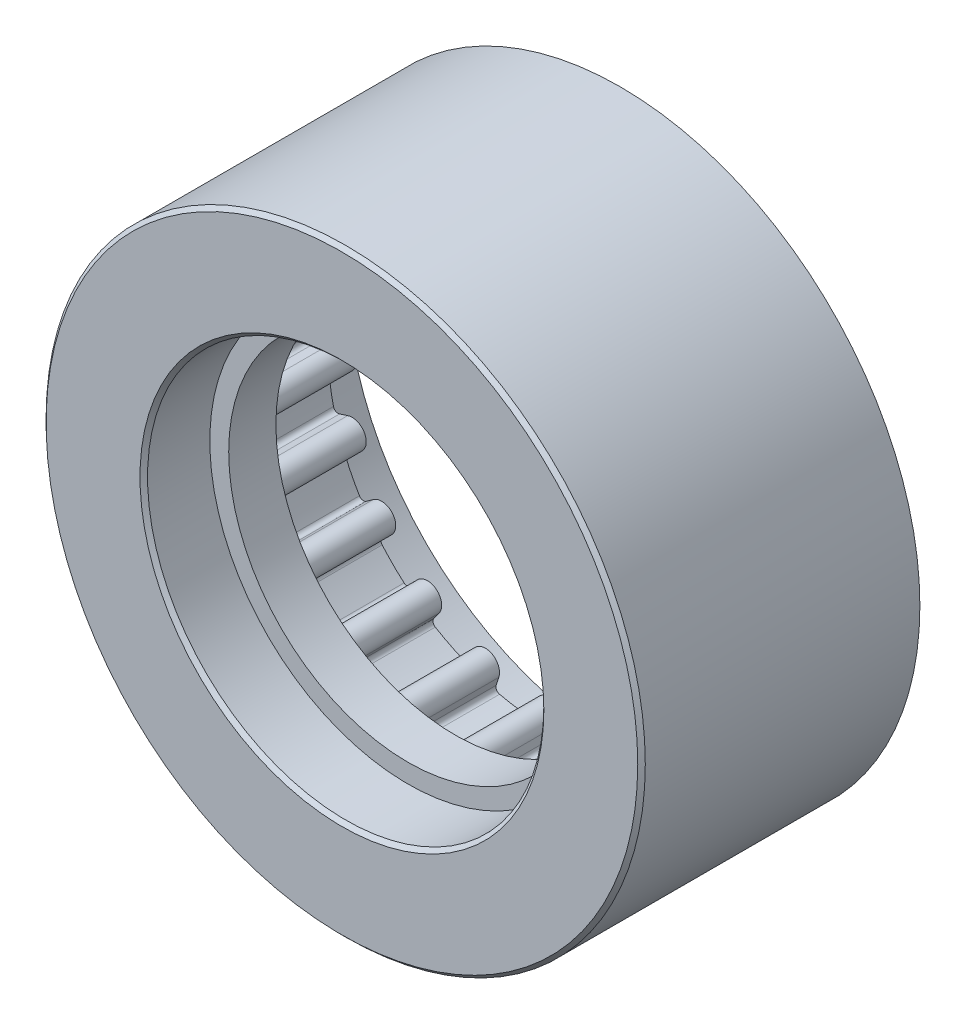
from build123d import *

# Parameters (mm, degrees)
SKIZZE1_W                       = 31.75
SKIZZE1_H                       = 17.5
SCHNITT_LINEAR_AUSTRAGEN1_DEPTH = 49.191026136
AUFSATZ_LINEAR_START            = 12
SKIZZE13_R                      = 31.75
SKIZZE13_R_2                    = 21
AUFSATZ_LINEAR_AUSTRAGEN1_DEPTH = 12
AUFSATZ_LINEAR_START_2          = -5
SKIZZE14_R                      = 21
SKIZZE14_R_2                    = 19
AUFSATZ_LINEAR_AUSTRAGEN2_DEPTH = 5
VERRUNDUNG1_R                   = 0.5
FASE5_SIZE                      = 0.4


with BuildPart() as part:
    # Skizze1 → Rotation1 (revolve)
    with BuildSketch(Plane.XZ, mode=Mode.PRIVATE) as rotation1_sk:
        with Locations((15.875, -0.15)):
            Rectangle(SKIZZE1_W, SKIZZE1_H)
    revolve(rotation1_sk.sketch.rotate(Axis((0, 0, 8.6), (0, 0, -1)), 180), axis=Axis((0, 0, 8.6), (0, 0, -1)))

    # Skizze2 → Schnitt-Linear austragen1 (cut, through all)
    with BuildSketch(Plane.XY.offset(8.6)):
        with BuildLine():
            ThreePointArc((1.5, 22), (0, 20.5), (-1.5, 22))
            Line((-1.5, 22), (-1.5, 23.452078799))
            ThreePointArc((-1.5, 23.452078799), (-3.676209928, 23.210676004), (-5.820506128, 22.767777854))
            Line((-5.820506128, 22.767777854), (-5.371789102, 21.38676885))
            ThreePointArc((-5.371789102, 21.38676885), (-5.316841365, 21.157895056), (-5.298373876, 20.923243358))
            ThreePointArc((-5.298373876, 20.923243358), (-6.563722179, 19.441710848), (-8.224958651, 20.459717867))
            Line((-8.224958651, 20.459717867), (-8.673675677, 21.840726871))
            ThreePointArc((-8.673675677, 21.840726871), (-10.668776744, 20.938653318), (-12.571260562, 19.85480818))
            Line((-12.571260562, 19.85480818), (-11.717750059, 18.680051755))
            ThreePointArc((-11.717750059, 18.680051755), (-11.504690776, 18.261899368), (-11.43127555, 17.798373876))
            ThreePointArc((-11.43127555, 17.798373876), (-12.467750059, 16.371789102), (-14.144801042, 16.916695998))
            Line((-14.144801042, 16.916695998), (-14.998311545, 18.091452423))
            ThreePointArc((-14.998311545, 18.091452423), (-16.617009358, 16.617009358), (-18.091452423, 14.998311545))
            Line((-18.091452423, 14.998311545), (-16.916695998, 14.144801042))
            ThreePointArc((-16.916695998, 14.144801042), (-16.46186409, 13.6122613), (-16.298373876, 12.93127555))
            ThreePointArc((-16.298373876, 12.93127555), (-17.117388127, 11.594765764), (-18.680051755, 11.717750059))
            Line((-18.680051755, 11.717750059), (-19.85480818, 12.571260562))
            ThreePointArc((-19.85480818, 12.571260562), (-20.938653318, 10.668776744), (-21.840726871, 8.673675677))
            Line((-21.840726871, 8.673675677), (-20.459717867, 8.224958651))
            ThreePointArc((-20.459717867, 8.224958651), (-19.709717867, 7.680051755), (-19.423243358, 6.798373876))
            ThreePointArc((-19.423243358, 6.798373876), (-20.04156548, 5.584848385), (-21.38676885, 5.371789102))
            Line((-21.38676885, 5.371789102), (-22.767777854, 5.820506128))
            ThreePointArc((-22.767777854, 5.820506128), (-23.210676004, 3.676209928), (-23.452078799, 1.5))
            Line((-23.452078799, 1.5), (-22, 1.5))
            ThreePointArc((-22, 1.5), (-20.939339828, 1.060660172), (-20.5, 0))
            ThreePointArc((-20.5, 0), (-20.939339828, -1.060660172), (-22, -1.5))
            Line((-22, -1.5), (-23.452078799, -1.5))
            ThreePointArc((-23.452078799, -1.5), (-23.210676004, -3.676209928), (-22.767777854, -5.820506128))
            Line((-22.767777854, -5.820506128), (-21.38676885, -5.371789102))
            ThreePointArc((-21.38676885, -5.371789102), (-20.04156548, -5.584848385), (-19.423243358, -6.798373876))
            ThreePointArc((-19.423243358, -6.798373876), (-19.709717867, -7.680051755), (-20.459717867, -8.224958651))
            Line((-20.459717867, -8.224958651), (-21.840726871, -8.673675677))
            ThreePointArc((-21.840726871, -8.673675677), (-20.938653318, -10.668776744), (-19.85480818, -12.571260562))
            Line((-19.85480818, -12.571260562), (-18.680051755, -11.717750059))
            ThreePointArc((-18.680051755, -11.717750059), (-17.117388127, -11.594765764), (-16.298373876, -12.93127555))
            ThreePointArc((-16.298373876, -12.93127555), (-16.46186409, -13.6122613), (-16.916695998, -14.144801042))
            Line((-16.916695998, -14.144801042), (-18.091452423, -14.998311545))
            ThreePointArc((-18.091452423, -14.998311545), (-16.617009358, -16.617009358), (-14.998311545, -18.091452423))
            Line((-14.998311545, -18.091452423), (-14.144801042, -16.916695998))
            ThreePointArc((-14.144801042, -16.916695998), (-12.467750059, -16.371789102), (-11.43127555, -17.798373876))
            ThreePointArc((-11.43127555, -17.798373876), (-11.504690776, -18.261899368), (-11.717750059, -18.680051755))
            Line((-11.717750059, -18.680051755), (-12.571260562, -19.85480818))
            ThreePointArc((-12.571260562, -19.85480818), (-10.668776744, -20.938653318), (-8.673675677, -21.840726871))
            Line((-8.673675677, -21.840726871), (-8.224958651, -20.459717867))
            ThreePointArc((-8.224958651, -20.459717867), (-6.563722179, -19.441710848), (-5.298373876, -20.923243358))
            ThreePointArc((-5.298373876, -20.923243358), (-5.316841365, -21.157895056), (-5.371789102, -21.38676885))
            Line((-5.371789102, -21.38676885), (-5.820506128, -22.767777854))
            ThreePointArc((-5.820506128, -22.767777854), (-3.676209928, -23.210676004), (-1.5, -23.452078799))
            Line((-1.5, -23.452078799), (-1.5, -22))
            ThreePointArc((-1.5, -22), (0, -20.5), (1.5, -22))
            Line((1.5, -22), (1.5, -23.452078799))
            ThreePointArc((1.5, -23.452078799), (3.676209928, -23.210676004), (5.820506128, -22.767777854))
            Line((5.820506128, -22.767777854), (5.371789102, -21.38676885))
            ThreePointArc((5.371789102, -21.38676885), (6.334848385, -19.496658584), (8.224958651, -20.459717867))
            Line((8.224958651, -20.459717867), (8.673675677, -21.840726871))
            ThreePointArc((8.673675677, -21.840726871), (10.668776744, -20.938653318), (12.571260562, -19.85480818))
            Line((12.571260562, -19.85480818), (11.717750059, -18.680051755))
            ThreePointArc((11.717750059, -18.680051755), (12.049597672, -16.584848385), (14.144801042, -16.916695998))
            Line((14.144801042, -16.916695998), (14.998311545, -18.091452423))
            ThreePointArc((14.998311545, -18.091452423), (16.617009358, -16.617009358), (18.091452423, -14.998311545))
            Line((18.091452423, -14.998311545), (16.916695998, -14.144801042))
            ThreePointArc((16.916695998, -14.144801042), (16.584848385, -12.049597672), (18.680051755, -11.717750059))
            Line((18.680051755, -11.717750059), (19.85480818, -12.571260562))
            ThreePointArc((19.85480818, -12.571260562), (20.938653318, -10.668776744), (21.840726871, -8.673675677))
            Line((21.840726871, -8.673675677), (20.459717867, -8.224958651))
            ThreePointArc((20.459717867, -8.224958651), (19.496658584, -6.334848385), (21.38676885, -5.371789102))
            Line((21.38676885, -5.371789102), (22.767777854, -5.820506128))
            ThreePointArc((22.767777854, -5.820506128), (23.210676004, -3.676209928), (23.452078799, -1.5))
            Line((23.452078799, -1.5), (22, -1.5))
            ThreePointArc((22, -1.5), (20.5, 0), (22, 1.5))
            Line((22, 1.5), (23.452078799, 1.5))
            ThreePointArc((23.452078799, 1.5), (23.210676004, 3.676209928), (22.767777854, 5.820506128))
            Line((22.767777854, 5.820506128), (21.38676885, 5.371789102))
            ThreePointArc((21.38676885, 5.371789102), (19.496658584, 6.334848385), (20.459717867, 8.224958651))
            Line((20.459717867, 8.224958651), (21.840726871, 8.673675677))
            ThreePointArc((21.840726871, 8.673675677), (20.938653318, 10.668776744), (19.85480818, 12.571260562))
            Line((19.85480818, 12.571260562), (18.680051755, 11.717750059))
            ThreePointArc((18.680051755, 11.717750059), (16.584848385, 12.049597672), (16.916695998, 14.144801042))
            Line((16.916695998, 14.144801042), (18.091452423, 14.998311545))
            ThreePointArc((18.091452423, 14.998311545), (16.617009358, 16.617009358), (14.998311545, 18.091452423))
            Line((14.998311545, 18.091452423), (14.144801042, 16.916695998))
            ThreePointArc((14.144801042, 16.916695998), (12.049597672, 16.584848385), (11.717750059, 18.680051755))
            Line((11.717750059, 18.680051755), (12.571260562, 19.85480818))
            ThreePointArc((12.571260562, 19.85480818), (10.668776744, 20.938653318), (8.673675677, 21.840726871))
            Line((8.673675677, 21.840726871), (8.224958651, 20.459717867))
            ThreePointArc((8.224958651, 20.459717867), (6.334848385, 19.496658584), (5.371789102, 21.38676885))
            Line((5.371789102, 21.38676885), (5.820506128, 22.767777854))
            ThreePointArc((5.820506128, 22.767777854), (3.676209928, 23.210676004), (1.5, 23.452078799))
            Line((1.5, 23.452078799), (1.5, 22))
        make_face()
    extrude(amount=-SCHNITT_LINEAR_AUSTRAGEN1_DEPTH, mode=Mode.SUBTRACT)

    # Skizze3 → Schnitt-Rotation1 (revolve, cut)
    with BuildSketch(Plane(origin=(0, 0, 0), x_dir=(1, 0, 0), z_dir=(0, 1, 0))):
        Polygon((29, 8.9), (0, 8.9), (0, 1.4), (26.5, 1.4), (27, 1.9), (29, 1.9), align=None)
    revolve(axis=Axis((0, 0, -8.9), (0, 0, 1)), mode=Mode.SUBTRACT)

    # Skizze13 → Aufsatz-Linear austragen1 (add)
    with BuildSketch(Plane.XY.offset(8.6).offset(AUFSATZ_LINEAR_START)):
        with Locations(Location((0, 0, 0), (0, 0, 180))):
            Circle(SKIZZE13_R)
        with Locations(Location((0, 0, 0), (0, 0, 182.980613219))):
            Circle(SKIZZE13_R_2, mode=Mode.SUBTRACT)
    extrude(amount=-AUFSATZ_LINEAR_AUSTRAGEN1_DEPTH)

    # Skizze14 → Aufsatz-Linear austragen2 (add)
    with BuildSketch(Plane(origin=(0, 0, 8.6), x_dir=(-1, 0, 0), z_dir=(0, 0, -1)).offset(AUFSATZ_LINEAR_START_2)):
        with Locations(Location((0, 0, 0), (0, 0, 180))):
            Circle(SKIZZE14_R)
        Circle(SKIZZE14_R_2, mode=Mode.SUBTRACT)
    extrude(amount=AUFSATZ_LINEAR_AUSTRAGEN2_DEPTH)

    # Verrundung1
    verrundung1_edges = [part.edges().sort_by_distance(p)[0] for p in [
        (-8.673675677, 21.840726871, 3.6),
        (-12.571260562, 19.85480818, 3.6),
        (-14.998311545, 18.091452423, 3.6),
        (-18.091452423, 14.998311545, 3.6),
        (-19.85480818, 12.571260562, 3.6),
        (-21.840726871, 8.673675677, 3.6),
        (-22.767777854, 5.820506128, 3.6),
        (-23.452078799, 1.5, 3.6),
        (-23.452078799, -1.5, 3.6),
        (-22.767777854, -5.820506128, 3.6),
        (-21.840726871, -8.673675677, 3.6),
        (-19.85480818, -12.571260562, 3.6),
        (-18.091452423, -14.998311545, 3.6),
        (-14.998311545, -18.091452423, 3.6),
        (-12.571260562, -19.85480818, 3.6),
        (-8.673675677, -21.840726871, 3.6),
        (-5.820506128, -22.767777854, 3.6),
        (-1.5, -23.452078799, 3.6),
        (1.5, -23.452078799, 3.6),
        (5.820506128, -22.767777854, 3.6),
        (8.673675677, -21.840726871, 3.6),
        (12.571260562, -19.85480818, 3.6),
        (14.998311545, -18.091452423, 3.6),
        (18.091452423, -14.998311545, 3.6),
        (19.85480818, -12.571260562, 3.6),
        (21.840726871, -8.673675677, 3.6),
        (22.767777854, -5.820506128, 3.6),
        (23.452078799, -1.5, 3.6),
        (23.452078799, 1.5, 3.6),
        (22.767777854, 5.820506128, 3.6),
        (21.840726871, 8.673675677, 3.6),
        (19.85480818, 12.571260562, 3.6),
        (18.091452423, 14.998311545, 3.6),
        (14.998311545, 18.091452423, 3.6),
        (12.571260562, 19.85480818, 3.6),
        (8.673675677, 21.840726871, 3.6),
        (5.820506128, 22.767777854, 3.6),
        (1.5, 23.452078799, 3.6),
        (-1.5, 23.452078799, 3.6),
        (-5.820506128, 22.767777854, 3.6),
    ]]
    fillet(verrundung1_edges, radius=VERRUNDUNG1_R)

    # Fase5
    fase5_edges = [part.edges().sort_by_distance(p)[0] for p in [
        (31.75, 0, 20.6),
        (20.971590909, 1.09195913, 20.6),
    ]]
    chamfer(fase5_edges, length=FASE5_SIZE)


solid = part.part
